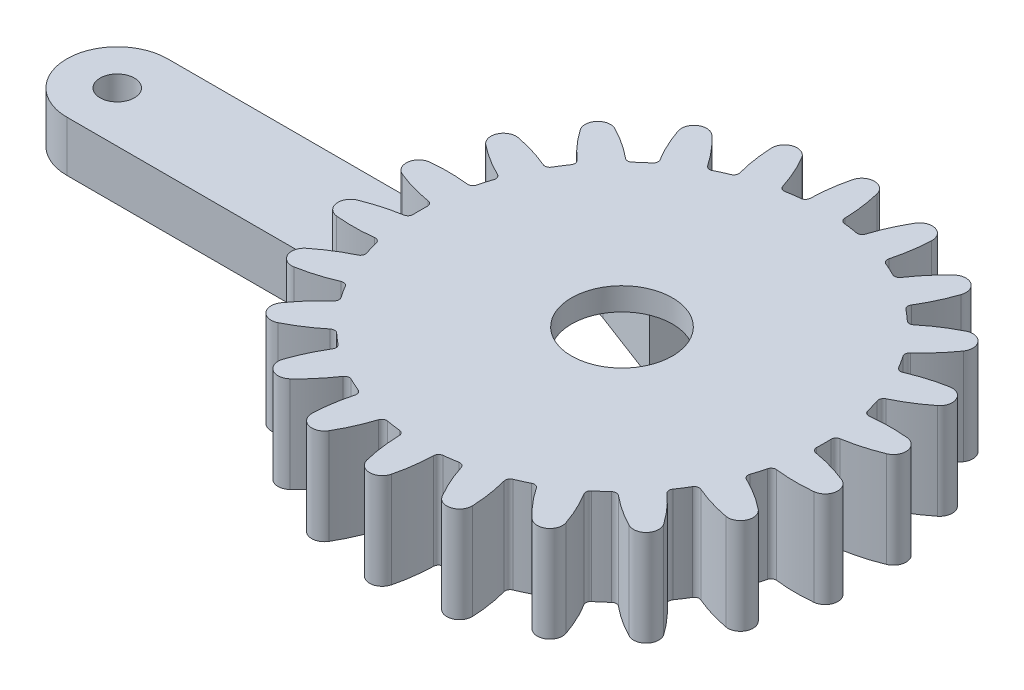
from build123d import *

# Parameters (mm, degrees)
BOSS_EXTRUDE1_DEPTH = 10
SKETCH2_R           = 1.7
BOSS_EXTRUDE2_DEPTH = 5
SKETCH3_R           = 5
CUT_EXTRUDE1_DEPTH  = 10
CUT_EXTRUDE2_DEPTH  = 7.25
SKETCH5_W           = 51.99875403
SKETCH5_H           = 52.635755718
CUT_EXTRUDE3_DEPTH  = 0.5


with BuildPart() as part:
    # Sketch1 → Boss-Extrude1 (new body)
    with BuildSketch(Plane(origin=(0, 0, 0), x_dir=(1, 0, 0), z_dir=(0, 1, 0))):
        with BuildLine():
            ThreePointArc((-2.153593112, 19.88371285), (-2.846296765, 19.796428838), (-3.535531802, 19.685020063))
            ThreePointArc((-3.535531802, 19.685020063), (-3.882136457, 19.748981681), (-4.100432499, 20.025699433))
            ThreePointArc((-4.100432499, 20.025699433), (-4.762053493, 21.765277365), (-5.613004812, 23.420498067))
            ThreePointArc((-5.613004812, 23.420498067), (-7.043313921, 23.98732434), (-7.940117093, 22.73719625))
            ThreePointArc((-7.940117093, 22.73719625), (-7.761103022, 20.884676969), (-7.377207186, 19.063551573))
            ThreePointArc((-7.377207186, 19.063551573), (-7.41124459, 18.712742037), (-7.66824672, 18.471545475))
            ThreePointArc((-7.66824672, 18.471545475), (-8.30830026, 18.192639907), (-8.938228956, 17.891564022))
            ThreePointArc((-8.938228956, 17.891564022), (-9.288813757, 17.855284929), (-9.576227675, 18.059292565))
            ThreePointArc((-9.576227675, 18.059292565), (-10.701144109, 19.542005194), (-11.983955481, 20.890437137))
            ThreePointArc((-11.983955481, 20.890437137), (-13.516020436, 21.031338321), (-14.024294995, 19.579190551))
            ThreePointArc((-14.024294995, 19.579190551), (-13.330617258, 17.85214541), (-12.449201587, 16.212944344))
            ThreePointArc((-12.449201587, 16.212944344), (-12.38302577, 15.866755614), (-12.561664583, 15.56292334))
            ThreePointArc((-12.561664583, 15.56292334), (-13.097214679, 15.114991487), (-13.616803957, 14.648639868))
            ThreePointArc((-13.616803957, 14.648639868), (-13.94296661, 14.515059181), (-14.276213837, 14.629829217))
            ThreePointArc((-14.276213837, 14.629829217), (-15.773291671, 15.735555983), (-17.384037348, 16.66795723))
            ThreePointArc((-17.384037348, 16.66795723), (-18.893739359, 16.371518349), (-18.972307922, 14.834995276))
            ThreePointArc((-18.972307922, 14.834995276), (-17.820164165, 13.3733392), (-16.512635714, 12.048860786))
            ThreePointArc((-16.512635714, 12.048860786), (-16.351607846, 11.735339014), (-16.437411089, 11.393485713))
            ThreePointArc((-16.437411089, 11.393485713), (-16.825070657, 10.812816349), (-17.192226484, 10.218970032))
            ThreePointArc((-17.192226484, 10.218970032), (-17.467543229, 9.998909663), (-17.819626058, 10.015144113))
            ThreePointArc((-17.819626058, 10.015144113), (-19.56758095, 10.654305609), (-21.375767896, 11.095138556))
            ThreePointArc((-21.375767896, 11.095138556), (-22.740799884, 10.385375325), (-22.383297294, 8.888956911))
            ThreePointArc((-22.383297294, 8.888956911), (-20.866027351, 7.811104583), (-19.238314299, 6.908650184))
            ThreePointArc((-19.238314299, 6.908650184), (-18.995479901, 6.65319504), (-18.981496306, 6.301015633))
            ThreePointArc((-18.981496306, 6.301015633), (-19.189859472, 5.634651137), (-19.374837068, 4.961420018))
            ThreePointArc((-19.374837068, 4.961420018), (-19.57700338, 4.67270795), (-19.919398153, 4.589091595))
            ThreePointArc((-19.919398153, 4.589091595), (-21.776621192, 4.709906759), (-23.635760856, 4.623457742))
            ThreePointArc((-23.635760856, 4.623457742), (-24.745536047, 3.557870957), (-23.980925039, 2.222788121))
            ThreePointArc((-23.980925039, 2.222788121), (-22.221449097, 1.616060727), (-20.405419075, 1.208741832))
            ThreePointArc((-20.405419075, 1.208741832), (-20.100451145, 1.032048772), (-19.987813579, 0.698074739))
            ThreePointArc((-19.987813579, 0.698074739), (-20, 0), (-19.987813579, -0.698074739))
            ThreePointArc((-19.987813579, -0.698074739), (-20.100451145, -1.032048772), (-20.405419075, -1.208741832))
            ThreePointArc((-20.405419075, -1.208741832), (-22.221449097, -1.616060727), (-23.980925039, -2.222788121))
            ThreePointArc((-23.980925039, -2.222788121), (-24.745536047, -3.557870957), (-23.635760856, -4.623457742))
            ThreePointArc((-23.635760856, -4.623457742), (-21.776621192, -4.709906759), (-19.919398153, -4.589091595))
            ThreePointArc((-19.919398153, -4.589091595), (-19.57700338, -4.67270795), (-19.374837068, -4.961420018))
            ThreePointArc((-19.374837068, -4.961420018), (-19.189859472, -5.634651137), (-18.981496306, -6.301015633))
            ThreePointArc((-18.981496306, -6.301015633), (-18.995479901, -6.65319504), (-19.238314299, -6.908650184))
            ThreePointArc((-19.238314299, -6.908650184), (-20.866027351, -7.811104583), (-22.383297294, -8.888956911))
            ThreePointArc((-22.383297294, -8.888956911), (-22.740799884, -10.385375325), (-21.375767896, -11.095138556))
            ThreePointArc((-21.375767896, -11.095138556), (-19.56758095, -10.654305609), (-17.819626058, -10.015144113))
            ThreePointArc((-17.819626058, -10.015144113), (-17.467543229, -9.998909663), (-17.192226484, -10.218970032))
            ThreePointArc((-17.192226484, -10.218970032), (-16.825070657, -10.812816349), (-16.437411089, -11.393485713))
            ThreePointArc((-16.437411089, -11.393485713), (-16.351607846, -11.735339014), (-16.512635714, -12.048860786))
            ThreePointArc((-16.512635714, -12.048860786), (-17.820164165, -13.3733392), (-18.972307922, -14.834995276))
            ThreePointArc((-18.972307922, -14.834995276), (-18.893739359, -16.371518349), (-17.384037348, -16.66795723))
            ThreePointArc((-17.384037348, -16.66795723), (-15.773291671, -15.735555983), (-14.276213837, -14.629829217))
            ThreePointArc((-14.276213837, -14.629829217), (-13.94296661, -14.515059181), (-13.616803957, -14.648639868))
            ThreePointArc((-13.616803957, -14.648639868), (-13.097214679, -15.114991487), (-12.561664583, -15.56292334))
            ThreePointArc((-12.561664583, -15.56292334), (-12.38302577, -15.866755614), (-12.449201587, -16.212944344))
            ThreePointArc((-12.449201587, -16.212944344), (-13.330617258, -17.85214541), (-14.024294995, -19.579190551))
            ThreePointArc((-14.024294995, -19.579190551), (-13.516020436, -21.031338321), (-11.983955481, -20.890437137))
            ThreePointArc((-11.983955481, -20.890437137), (-10.701144109, -19.542005194), (-9.576227675, -18.059292565))
            ThreePointArc((-9.576227675, -18.059292565), (-9.288813757, -17.855284929), (-8.938228956, -17.891564022))
            ThreePointArc((-8.938228956, -17.891564022), (-8.30830026, -18.192639907), (-7.66824672, -18.471545475))
            ThreePointArc((-7.66824672, -18.471545475), (-7.41124459, -18.712742037), (-7.377207186, -19.063551573))
            ThreePointArc((-7.377207186, -19.063551573), (-7.761103022, -20.884676969), (-7.940117093, -22.73719625))
            ThreePointArc((-7.940117093, -22.73719625), (-7.043313921, -23.98732434), (-5.613004812, -23.420498067))
            ThreePointArc((-5.613004812, -23.420498067), (-4.762053493, -21.765277365), (-4.100432499, -20.025699433))
            ThreePointArc((-4.100432499, -20.025699433), (-3.882136457, -19.748981681), (-3.535531802, -19.685020063))
            ThreePointArc((-3.535531802, -19.685020063), (-2.846296765, -19.796428838), (-2.153593112, -19.88371285))
            ThreePointArc((-2.153593112, -19.88371285), (-1.839048451, -20.042733389), (-1.707555332, -20.369743229))
            ThreePointArc((-1.707555332, -20.369743229), (-1.562830376, -22.225256207), (-1.212678125, -24.053169531))
            ThreePointArc((-1.212678125, -24.053169531), (0, -25), (1.212678125, -24.053169531))
            ThreePointArc((1.212678125, -24.053169531), (1.562830376, -22.225256207), (1.707555332, -20.369743229))
            ThreePointArc((1.707555332, -20.369743229), (1.839048451, -20.042733389), (2.153593112, -19.88371285))
            ThreePointArc((2.153593112, -19.88371285), (2.846296765, -19.796428838), (3.535531802, -19.685020063))
            ThreePointArc((3.535531802, -19.685020063), (3.882136457, -19.748981681), (4.100432499, -20.025699433))
            ThreePointArc((4.100432499, -20.025699433), (4.762053493, -21.765277365), (5.613004812, -23.420498067))
            ThreePointArc((5.613004812, -23.420498067), (7.043313921, -23.98732434), (7.940117093, -22.73719625))
            ThreePointArc((7.940117093, -22.73719625), (7.761103022, -20.884676969), (7.377207186, -19.063551573))
            ThreePointArc((7.377207186, -19.063551573), (7.41124459, -18.712742037), (7.66824672, -18.471545475))
            ThreePointArc((7.66824672, -18.471545475), (8.30830026, -18.192639907), (8.938228956, -17.891564022))
            ThreePointArc((8.938228956, -17.891564022), (9.288813757, -17.855284929), (9.576227675, -18.059292565))
            ThreePointArc((9.576227675, -18.059292565), (10.701144109, -19.542005194), (11.983955481, -20.890437137))
            ThreePointArc((11.983955481, -20.890437137), (13.516020436, -21.031338321), (14.024294995, -19.579190551))
            ThreePointArc((14.024294995, -19.579190551), (13.330617258, -17.85214541), (12.449201587, -16.212944344))
            ThreePointArc((12.449201587, -16.212944344), (12.38302577, -15.866755614), (12.561664583, -15.56292334))
            ThreePointArc((12.561664583, -15.56292334), (13.097214679, -15.114991487), (13.616803957, -14.648639868))
            ThreePointArc((13.616803957, -14.648639868), (13.94296661, -14.515059181), (14.276213837, -14.629829217))
            ThreePointArc((14.276213837, -14.629829217), (15.773291671, -15.735555983), (17.384037348, -16.66795723))
            ThreePointArc((17.384037348, -16.66795723), (18.893739359, -16.371518349), (18.972307922, -14.834995276))
            ThreePointArc((18.972307922, -14.834995276), (17.820164165, -13.3733392), (16.512635714, -12.048860786))
            ThreePointArc((16.512635714, -12.048860786), (16.351607846, -11.735339014), (16.437411089, -11.393485713))
            ThreePointArc((16.437411089, -11.393485713), (16.825070657, -10.812816349), (17.192226484, -10.218970032))
            ThreePointArc((17.192226484, -10.218970032), (17.467543229, -9.998909663), (17.819626058, -10.015144113))
            ThreePointArc((17.819626058, -10.015144113), (19.56758095, -10.654305609), (21.375767896, -11.095138556))
            ThreePointArc((21.375767896, -11.095138556), (22.740799884, -10.385375325), (22.383297294, -8.888956911))
            ThreePointArc((22.383297294, -8.888956911), (20.866027351, -7.811104583), (19.238314299, -6.908650184))
            ThreePointArc((19.238314299, -6.908650184), (18.995479901, -6.65319504), (18.981496306, -6.301015633))
            ThreePointArc((18.981496306, -6.301015633), (19.189859472, -5.634651137), (19.374837068, -4.961420018))
            ThreePointArc((19.374837068, -4.961420018), (19.57700338, -4.67270795), (19.919398153, -4.589091595))
            ThreePointArc((19.919398153, -4.589091595), (21.776621192, -4.709906759), (23.635760856, -4.623457742))
            ThreePointArc((23.635760856, -4.623457742), (24.745536047, -3.557870957), (23.980925039, -2.222788121))
            ThreePointArc((23.980925039, -2.222788121), (22.221449097, -1.616060727), (20.405419075, -1.208741832))
            ThreePointArc((20.405419075, -1.208741832), (20.100451145, -1.032048772), (19.987813579, -0.698074739))
            ThreePointArc((19.987813579, -0.698074739), (20, 0), (19.987813579, 0.698074739))
            ThreePointArc((19.987813579, 0.698074739), (20.100451145, 1.032048772), (20.405419075, 1.208741832))
            ThreePointArc((20.405419075, 1.208741832), (22.221449097, 1.616060727), (23.980925039, 2.222788121))
            ThreePointArc((23.980925039, 2.222788121), (24.745536047, 3.557870957), (23.635760856, 4.623457742))
            ThreePointArc((23.635760856, 4.623457742), (21.776621192, 4.709906759), (19.919398153, 4.589091595))
            ThreePointArc((19.919398153, 4.589091595), (19.57700338, 4.67270795), (19.374837068, 4.961420018))
            ThreePointArc((19.374837068, 4.961420018), (19.189859472, 5.634651137), (18.981496306, 6.301015633))
            ThreePointArc((18.981496306, 6.301015633), (18.995479901, 6.65319504), (19.238314299, 6.908650184))
            ThreePointArc((19.238314299, 6.908650184), (20.866027351, 7.811104583), (22.383297294, 8.888956911))
            ThreePointArc((22.383297294, 8.888956911), (22.740799884, 10.385375325), (21.375767896, 11.095138556))
            ThreePointArc((21.375767896, 11.095138556), (19.56758095, 10.654305609), (17.819626058, 10.015144113))
            ThreePointArc((17.819626058, 10.015144113), (17.467543229, 9.998909663), (17.192226484, 10.218970032))
            ThreePointArc((17.192226484, 10.218970032), (16.825070657, 10.812816349), (16.437411089, 11.393485713))
            ThreePointArc((16.437411089, 11.393485713), (16.351607846, 11.735339014), (16.512635714, 12.048860786))
            ThreePointArc((16.512635714, 12.048860786), (17.820164165, 13.3733392), (18.972307922, 14.834995276))
            ThreePointArc((18.972307922, 14.834995276), (18.893739359, 16.371518349), (17.384037348, 16.66795723))
            ThreePointArc((17.384037348, 16.66795723), (15.773291671, 15.735555983), (14.276213837, 14.629829217))
            ThreePointArc((14.276213837, 14.629829217), (13.94296661, 14.515059181), (13.616803957, 14.648639868))
            ThreePointArc((13.616803957, 14.648639868), (13.097214679, 15.114991487), (12.561664583, 15.56292334))
            ThreePointArc((12.561664583, 15.56292334), (12.38302577, 15.866755614), (12.449201587, 16.212944344))
            ThreePointArc((12.449201587, 16.212944344), (13.330617258, 17.85214541), (14.024294995, 19.579190551))
            ThreePointArc((14.024294995, 19.579190551), (13.516020436, 21.031338321), (11.983955481, 20.890437137))
            ThreePointArc((11.983955481, 20.890437137), (10.701144109, 19.542005194), (9.576227675, 18.059292565))
            ThreePointArc((9.576227675, 18.059292565), (9.288813757, 17.855284929), (8.938228956, 17.891564022))
            ThreePointArc((8.938228956, 17.891564022), (8.30830026, 18.192639907), (7.66824672, 18.471545475))
            ThreePointArc((7.66824672, 18.471545475), (7.41124459, 18.712742037), (7.377207186, 19.063551573))
            ThreePointArc((7.377207186, 19.063551573), (7.761103022, 20.884676969), (7.940117093, 22.73719625))
            ThreePointArc((7.940117093, 22.73719625), (7.043313921, 23.98732434), (5.613004812, 23.420498067))
            ThreePointArc((5.613004812, 23.420498067), (4.762053493, 21.765277365), (4.100432499, 20.025699433))
            ThreePointArc((4.100432499, 20.025699433), (3.882136457, 19.748981681), (3.535531802, 19.685020063))
            ThreePointArc((3.535531802, 19.685020063), (2.846296765, 19.796428838), (2.153593112, 19.88371285))
            ThreePointArc((2.153593112, 19.88371285), (1.839048451, 20.042733389), (1.707555332, 20.369743229))
            ThreePointArc((1.707555332, 20.369743229), (1.562830376, 22.225256207), (1.212678125, 24.053169531))
            ThreePointArc((1.212678125, 24.053169531), (0, 25), (-1.212678125, 24.053169531))
            ThreePointArc((-1.212678125, 24.053169531), (-1.562830376, 22.225256207), (-1.707555332, 20.369743229))
            ThreePointArc((-1.707555332, 20.369743229), (-1.839048451, 20.042733389), (-2.153593112, 19.88371285))
        make_face()
    extrude(amount=BOSS_EXTRUDE1_DEPTH)

    # Sketch2 → Boss-Extrude2 (add)
    with BuildSketch(Plane.XZ):
        with BuildLine():
            Line((0, -5), (-50, -5))
            ThreePointArc((-50, -5), (-55, 0), (-50, 5))
            Line((-50, 5), (0, 5))
            ThreePointArc((0, 5), (5, 0), (0, -5))
        make_face()
        with Locations(Location((-50, 0, 0), (0, 0, 270))):
            Circle(SKETCH2_R, mode=Mode.SUBTRACT)
    extrude(amount=-BOSS_EXTRUDE2_DEPTH)

    # Sketch3 → Cut-Extrude1 (cut)
    with BuildSketch(Plane(origin=(0, 10, 0), x_dir=(1, 0, 0), z_dir=(0, 1, 0))):
        with Locations(Location((0, 0, 0), (0, 0, 270))):
            Circle(SKETCH3_R)
    extrude(amount=-CUT_EXTRUDE1_DEPTH, mode=Mode.SUBTRACT)

    # Sketch4 → Cut-Extrude2 (cut)
    with BuildSketch(Plane.XZ):
        with BuildLine():
            Line((-3.75, 6.5), (-2.467708079, 14.400520706))
            ThreePointArc((-2.467708079, 14.400520706), (0, 16.5), (2.467708079, 14.400520706))
            Line((2.467708079, 14.400520706), (3.75, 6.5))
            Line((3.75, 6.5), (3.754165125, 6.497595264))
            Line((3.754165125, 6.497595264), (11.23736272, 9.337358239))
            ThreePointArc((11.23736272, 9.337358239), (14.289419162, 8.25), (13.705070799, 5.063162467))
            Line((13.705070799, 5.063162467), (7.504165125, 0.002404736))
            Line((7.504165125, 0.002404736), (7.504165125, -0.002404736))
            Line((7.504165125, -0.002404736), (13.705070799, -5.063162467))
            ThreePointArc((13.705070799, -5.063162467), (14.289419162, -8.25), (11.23736272, -9.337358239))
            Line((11.23736272, -9.337358239), (3.754165125, -6.497595264))
            Line((3.754165125, -6.497595264), (3.75, -6.5))
            Line((3.75, -6.5), (2.467708079, -14.400520706))
            ThreePointArc((2.467708079, -14.400520706), (0, -16.5), (-2.467708079, -14.400520706))
            Line((-2.467708079, -14.400520706), (-3.75, -6.5))
            Line((-3.75, -6.5), (-3.754165125, -6.497595264))
            Line((-3.754165125, -6.497595264), (-11.23736272, -9.337358239))
            ThreePointArc((-11.23736272, -9.337358239), (-14.289419162, -8.25), (-13.705070799, -5.063162467))
            Line((-13.705070799, -5.063162467), (-7.504165125, -0.002404736))
            Line((-7.504165125, -0.002404736), (-7.504165125, 0.002404736))
            Line((-7.504165125, 0.002404736), (-13.705070799, 5.063162467))
            ThreePointArc((-13.705070799, 5.063162467), (-14.289419162, 8.25), (-11.23736272, 9.337358239))
            Line((-11.23736272, 9.337358239), (-3.754165125, 6.497595264))
            Line((-3.754165125, 6.497595264), (-3.75, 6.5))
        make_face()
    extrude(amount=-CUT_EXTRUDE2_DEPTH, mode=Mode.SUBTRACT)

    # Sketch5 → Cut-Extrude3 (cut)
    with BuildSketch(Plane(origin=(0, 10, 0), x_dir=(1, 0, 0), z_dir=(0, 1, 0))):
        Rectangle(SKETCH5_W, SKETCH5_H)
    extrude(amount=-CUT_EXTRUDE3_DEPTH, mode=Mode.SUBTRACT)


solid = part.part
